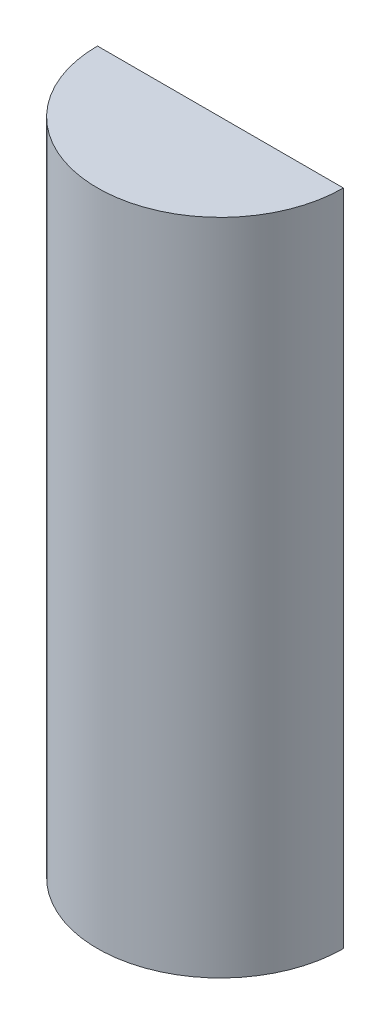
from build123d import *

# Parameters (mm, degrees)
EXTRUDE_1_DEPTH = 30


with BuildPart() as part:
    # 草图1 → 凸台-拉伸1 (new body)
    with BuildSketch(Plane(origin=(0, 0, 0), x_dir=(1, 0, 0), z_dir=(0, 1, 0))):
        with BuildLine():
            Line((-5.6, 0), (5.6, 0))
            ThreePointArc((5.6, 0), (0, -5.6), (-5.6, 0))
        make_face()
    extrude(amount=EXTRUDE_1_DEPTH)


solid = part.part
